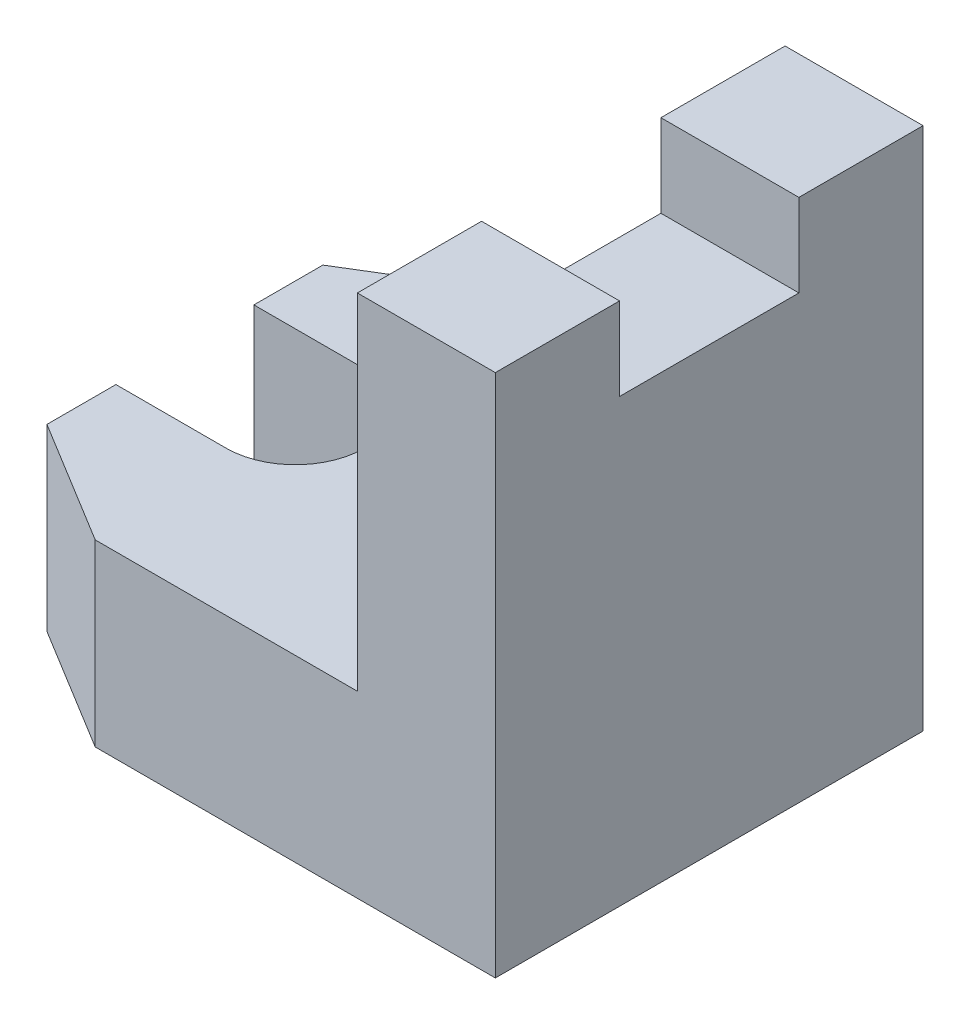
from build123d import *

# Parameters (mm, degrees)
EXTRUDE_1_DEPTH     = 13
SKETCH_2_W          = 10
SKETCH_2_H          = 31
EXTRUDE_2_DEPTH     = 25
SKETCH_3_W          = 10
SKETCH_3_H          = 13
CUT_EXTRUDE_1_DEPTH = 6


with BuildPart() as part:
    # 草图1 → 凸台-拉伸1 (new body)
    with BuildSketch(Plane(origin=(0, 0, 0), x_dir=(1, 0, 0), z_dir=(0, 1, 0))):
        with BuildLine():
            Line((0, 5), (-8, 5))
            Line((-8, 5), (-8, 10))
            Line((-8, 10), (1, 15.5))
            Line((1, 15.5), (30, 15.5))
            Line((30, 15.5), (30, -15.5))
            Line((30, -15.5), (1, -15.5))
            Line((1, -15.5), (-8, -10))
            Line((-8, -10), (-8, -5))
            Line((-8, -5), (0, -5))
            ThreePointArc((0, -5), (5, 0), (0, 5))
        make_face()
    extrude(amount=EXTRUDE_1_DEPTH)

    # 草图2 → 凸台-拉伸2 (add)
    with BuildSketch(Plane(origin=(0, 13, 0), x_dir=(1, 0, 0), z_dir=(0, 1, 0))):
        with Locations((25, 0)):
            Rectangle(SKETCH_2_W, SKETCH_2_H)
    extrude(amount=EXTRUDE_2_DEPTH)

    # 草图3 → 切除-拉伸1 (cut)
    with BuildSketch(Plane(origin=(0, 38, 0), x_dir=(1, 0, 0), z_dir=(0, 1, 0))):
        with Locations((25, 0)):
            Rectangle(SKETCH_3_W, SKETCH_3_H)
    extrude(amount=-CUT_EXTRUDE_1_DEPTH, mode=Mode.SUBTRACT)


solid = part.part
